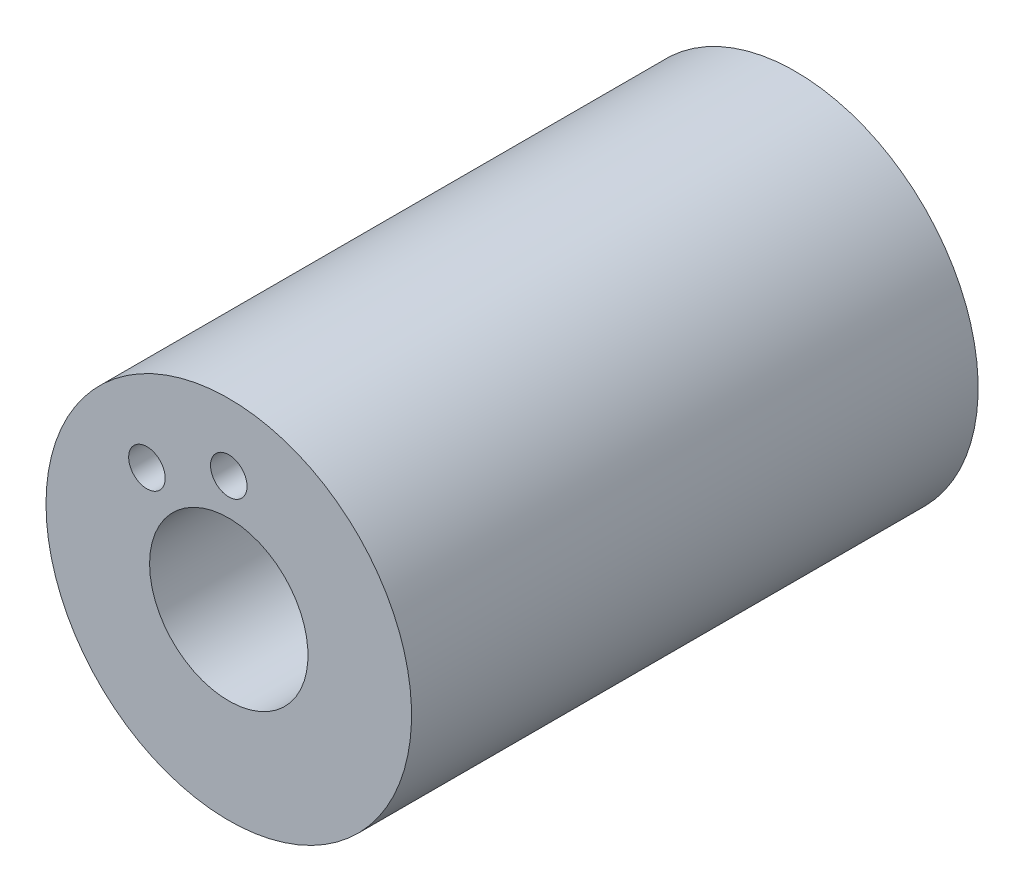
from build123d import *

# Parameters (mm, degrees)
SKETCH1_R           = 15
SKETCH1_R_2         = 6.5
SKETCH1_R_3         = 1.5
BOSS_EXTRUDE1_DEPTH = 23.25


with BuildPart() as part:
    # Sketch1 → Boss-Extrude1 (new, symmetric)
    with BuildSketch(Plane.XY):
        with Locations(Location((0, 0, 0), (0, 0, 180))):
            Circle(SKETCH1_R)
        with Locations(Location((0, 0, 0), (0, 0, 180))):
            Circle(SKETCH1_R_2, mode=Mode.SUBTRACT)
        with Locations(Location((0, 9.5, 0), (0, 0, 180))):
            Circle(SKETCH1_R_3, mode=Mode.SUBTRACT)
        with Locations(Location((-6.717514421, 6.717514421, 0), (0, 0, 180))):
            Circle(SKETCH1_R_3, mode=Mode.SUBTRACT)
    extrude(amount=BOSS_EXTRUDE1_DEPTH, both=True)


solid = part.part
